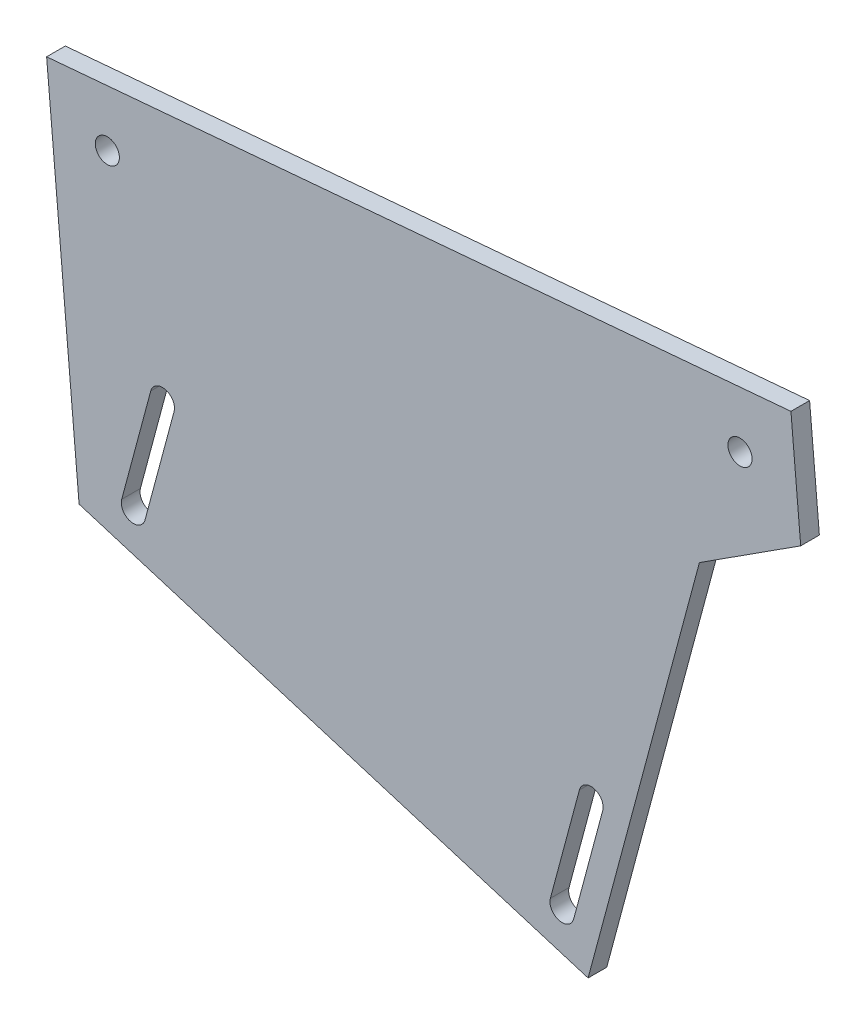
from build123d import *

# Parameters (mm, degrees)
SKETCH2_R           = 4.1021
BOSS_EXTRUDE2_DEPTH = 6.35


with BuildPart() as part:
    # Sketch2 → Boss-Extrude2 (new body)
    with BuildSketch(Plane.XY):
        Polygon((416.876840794, 161.047876949), (163.843387479, 138.910318291), (174.883865248, 12.717079939), (347.922940958, -40.266575593), (385.763827966, 100.957537323), (420.197474593, 123.092858952), align=None)
        with Locations((184.481213377, 121.593126192)):
            Circle(SKETCH2_R, mode=Mode.SUBTRACT)
        with Locations((399.559648695, 140.410051051)):
            Circle(SKETCH2_R, mode=Mode.SUBTRACT)
        with BuildLine():
            Line((352.884248555, 11.469011076), (343.023242936, -25.332762905))
            ThreePointArc((343.023242936, -25.332762905), (337.999216999, -28.233385633), (335.098594272, -23.209359696))
            Line((335.098594272, -23.209359696), (344.959599891, 13.592414286))
            ThreePointArc((344.959599891, 13.592414286), (349.983625828, 16.493037013), (352.884248555, 11.469011076))
        make_face(mode=Mode.SUBTRACT)
        with BuildLine():
            ThreePointArc((199.237675668, 58.211701605), (204.261701605, 61.112324332), (207.162324332, 56.088298395))
            Line((207.162324332, 56.088298395), (197.301318714, 19.286524413))
            ThreePointArc((197.301318714, 19.286524413), (192.277292777, 16.385901686), (189.37667005, 21.409927623))
            Line((189.37667005, 21.409927623), (199.237675668, 58.211701605))
        make_face(mode=Mode.SUBTRACT)
    extrude(amount=BOSS_EXTRUDE2_DEPTH)


solid = part.part
